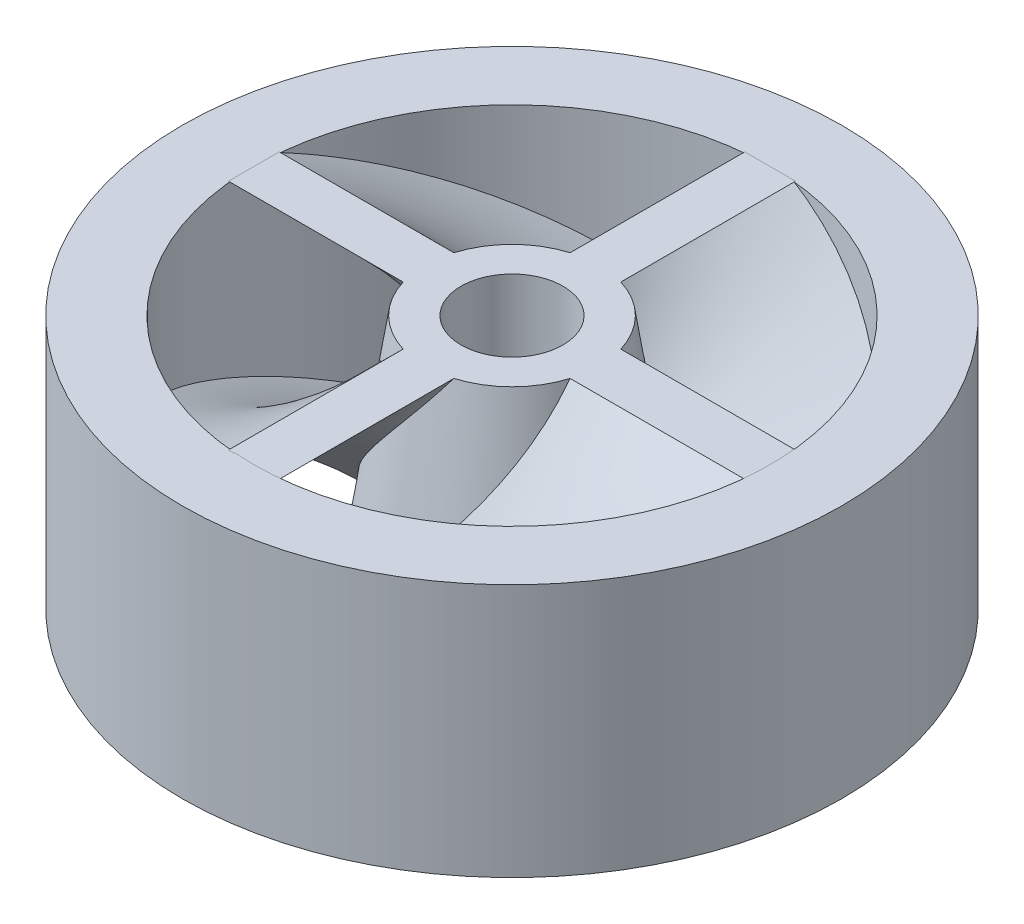
from build123d import *

# Parameters (mm, degrees)
SWEEP1_PITCH           = 38.862
SWEEP1_HEIGHT          = 12.7
SWEEP1_RADIUS          = 12.9286
SWEEP1_START_ANGLE     = 180
SKETCH2_W              = 2.54
SKETCH2_H              = 12.9286
CIRPATTERN1_COUNT      = 4
F_10_CLEARANCE_HOLE1_D = 5.1054
SKETCH11_W             = 3.5814
SKETCH11_H             = 12.7


with BuildPart() as part:
    # Sweep1: sweep along a helix
    with BuildLine() as sweep1_path:
        add(Helix(SWEEP1_PITCH, SWEEP1_HEIGHT, SWEEP1_RADIUS, center=(0, 0, 0), direction=(0, -1, 0), mode=Mode.PRIVATE).rotate(Axis((0, 0, 0), (0, -1, 0)), SWEEP1_START_ANGLE))
    # Sketch2 → Sweep1 (sweep)
    with BuildSketch(Plane(origin=(0, 0, 0), x_dir=(1, 0, 0), z_dir=(0, 1, 0))):
        with Locations((0, -6.4643)):
            Rectangle(SKETCH2_W, SKETCH2_H)
    sweep1 = sweep(path=sweep1_path.line, is_frenet=True)

    # Sketch4 → Revolve1 (revolve)
    with BuildSketch(Plane.XY):
        Polygon((0, 0), (0, -12.700196986), (6.35, -12.700196986), (4.3688, 0), align=None)
    revolve(axis=Axis((0, 0, 0), (0, -1, 0)))

    # CirPattern1: Sweep1 ×4 about axis
    cirpattern1_axis = Axis((0, 28.922533895, 0), (0, -1, 0))
    for i in range(1, CIRPATTERN1_COUNT):
        add(sweep1.rotate(cirpattern1_axis, i * 360 / CIRPATTERN1_COUNT))

    # #10 Clearance Hole1 (through all)
    with Locations(Plane.ZX):
        with Locations((0, 0)):
            Hole(F_10_CLEARANCE_HOLE1_D / 2)


with BuildPart() as body_2:
    # Sketch11 → Revolve2 (revolve)
    with BuildSketch(Plane.XY, mode=Mode.PRIVATE) as revolve2_sk:
        with Locations((14.7193, -6.35)):
            Rectangle(SKETCH11_W, SKETCH11_H)
    revolve(revolve2_sk.sketch.rotate(Axis((0, 28.922533895, 0), (0, -1, 0)), 90), axis=Axis((0, 28.922533895, 0), (0, -1, 0)))


solid = Compound([part.part, body_2.part])
